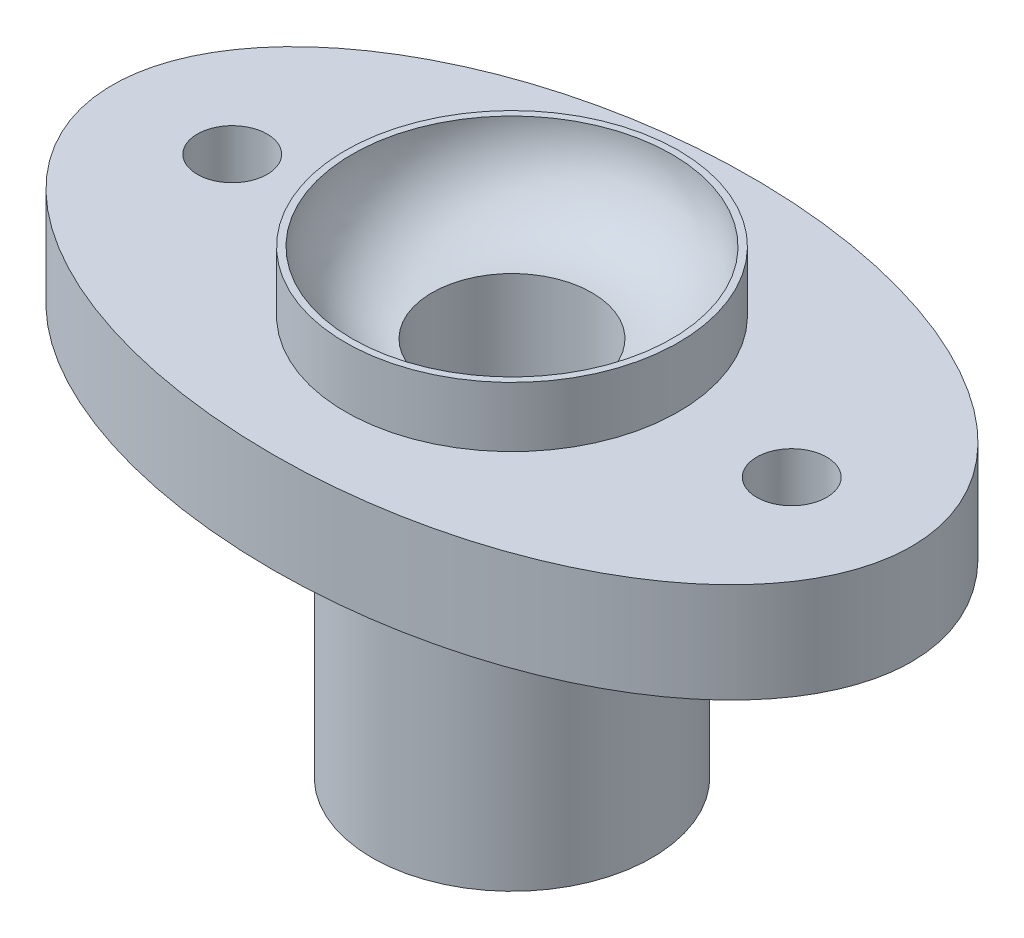
from build123d import *

# Parameters (mm, degrees)
CUT_EXTRUDE_1_DEPTH      = 104.923048454
CUT_EXTRUDE_1_DEPTH_BACK = 104.923048454
CUT_EXTRUDE_2_REACH      = 94.174
SKETCH_3_R               = 5.25


with BuildPart() as part:
    # 草图1 → 旋转1 (revolve)
    with BuildSketch(Plane.XY, mode=Mode.PRIVATE) as revolve_1_sk:
        with BuildLine():
            Line((25, 69), (24, 69))
            ThreePointArc((24, 69), (20.485281374, 60.514718626), (12, 57))
            Line((12, 57), (12, 2.411542732))
            Line((12, 2.411542732), (21, 0))
            Line((21, 0), (21, 45))
            Line((21, 45), (60, 45))
            Line((60, 45), (60, 60))
            Line((60, 60), (25, 60))
            Line((25, 60), (25, 69))
        make_face()
    revolve(revolve_1_sk.sketch.rotate(Axis((0, 0, 0), (0, 1, 0)), 90), axis=Axis((0, 0, 0), (0, 1, 0)))

    # 草图2 → 切除-拉伸1 (cut, two sides: drawn at the far end of the back side and taken through both)
    with BuildSketch(Plane(origin=(0, 60, 0), x_dir=(1, 0, 0), z_dir=(0, 1, 0)).offset(-CUT_EXTRUDE_1_DEPTH_BACK)):
        with BuildLine():
            add(Edge.make_bspline(
                [(60, 0), (60, 36.000000111), (-1.85e-07, 36), (-60.00000037, 35.999999889), (-60, -2.22e-07)],
                knots=[0, 0, 0, 1.57079633, 1.57079633, 3.14159266, 3.14159266, 3.14159266], degree=2, weights=[1, 0.70710678, 1, 0.70710678, 1]))
            ThreePointArc((60, 0), (-1.11e-07, 60), (-60, -2.22e-07))
        make_face()
        with BuildLine():
            ThreePointArc((-60, -2.22e-07), (1.11e-07, -60), (60, 0))
            add(Edge.make_bspline(
                [(-60, -2.22e-07), (-59.99999963, -36.000000111), (1.85e-07, -36), (60, -35.999999889), (60, 0)],
                knots=[3.14159266, 3.14159266, 3.14159266, 4.712388983, 4.712388983, 6.283185307, 6.283185307, 6.283185307], degree=2, weights=[1, 0.707106782, 1, 0.707106782, 1]))
        make_face()
    extrude(amount=CUT_EXTRUDE_1_DEPTH + CUT_EXTRUDE_1_DEPTH_BACK, mode=Mode.SUBTRACT)

    # 草图3 → 切除-拉伸2 (cut, up to next)
    with BuildSketch(Plane(origin=(0, 60, 0), x_dir=(1, 0, 0), z_dir=(0, 1, 0)), mode=Mode.PRIVATE) as cut_extrude_2_sk1:
        with Locations(Location((42, 0, 0), (0, 0, 270))):
            Circle(SKETCH_3_R)
    cut_extrude_2_tool1 = extrude(cut_extrude_2_sk1.sketch, amount=-CUT_EXTRUDE_2_REACH, mode=Mode.PRIVATE) & part.part
    # 草图3 → 切除-拉伸2 (cut, up to next)
    with BuildSketch(Plane(origin=(0, 60, 0), x_dir=(1, 0, 0), z_dir=(0, 1, 0)), mode=Mode.PRIVATE) as cut_extrude_2_sk2:
        with Locations(Location((-42, 0, 0), (0, 0, 90))):
            Circle(SKETCH_3_R)
    cut_extrude_2_tool2 = extrude(cut_extrude_2_sk2.sketch, amount=-CUT_EXTRUDE_2_REACH, mode=Mode.PRIVATE) & part.part
    add(cut_extrude_2_tool1.solids().sort_by_distance((42, 60, 0))[0], mode=Mode.SUBTRACT)
    add(cut_extrude_2_tool2.solids().sort_by_distance((-42, 60, 0))[0], mode=Mode.SUBTRACT)


solid = part.part
